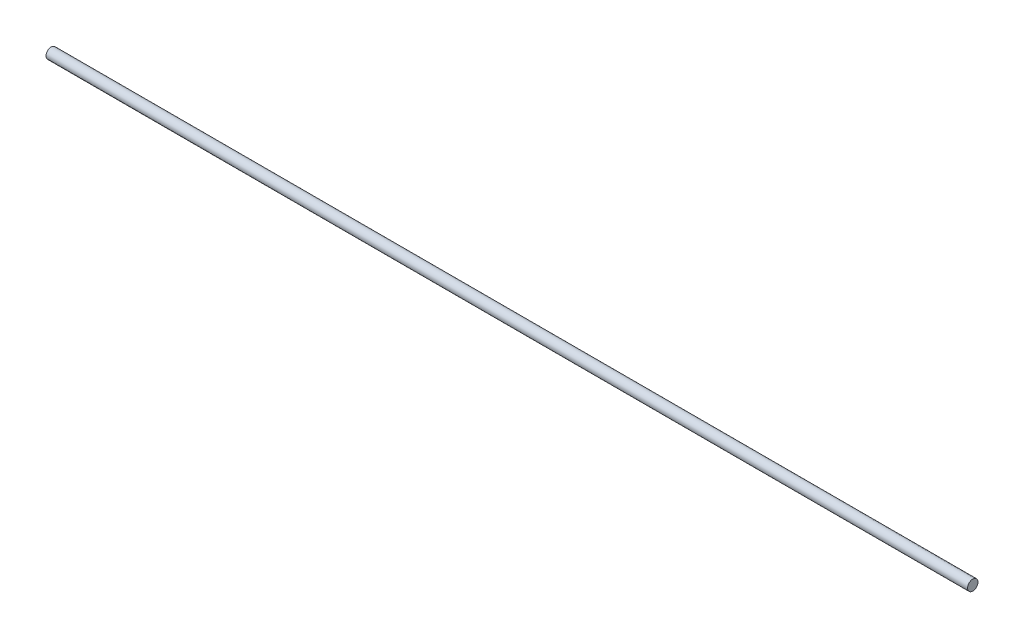
from build123d import *

# Parameters (mm, degrees)
SKETCH1_R           = 6.35
BOSS_EXTRUDE1_DEPTH = 1122.172


with BuildPart() as part:
    # Sketch1 → Boss-Extrude1 (new body)
    with BuildSketch(Plane.YZ):
        with Locations(Location((0, 0, 0), (0, 0, 270))):
            Circle(SKETCH1_R)
    extrude(amount=BOSS_EXTRUDE1_DEPTH)


solid = part.part
